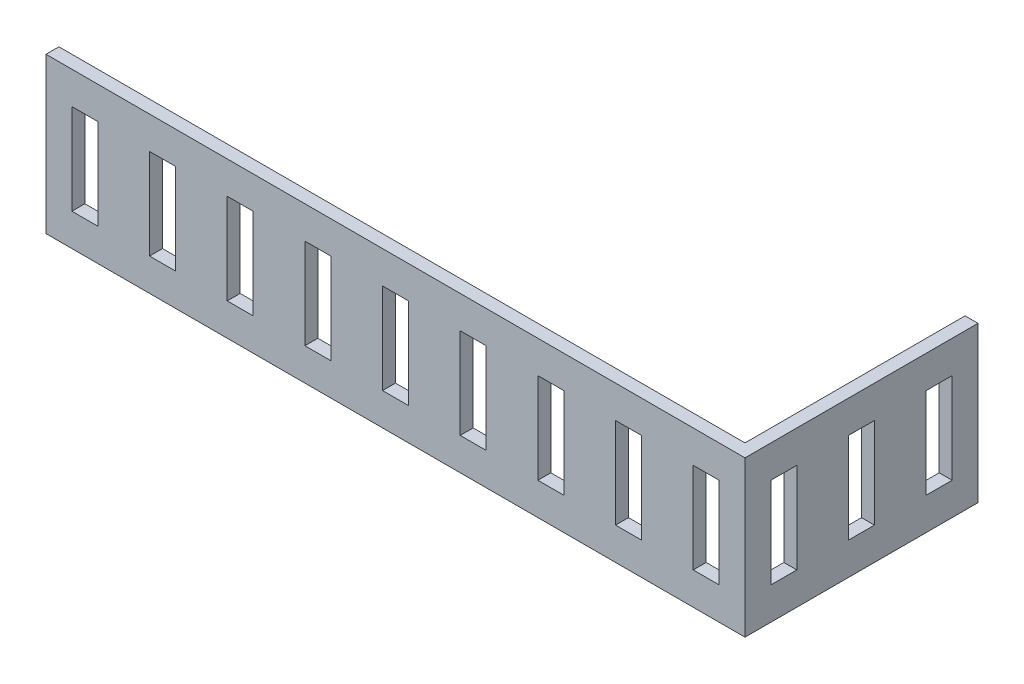
from build123d import *

# Parameters (mm, degrees)
EXTRUDE_1_DEPTH     = 6
SKETCH_2_W          = 1
SKETCH_2_H          = 3.5
CUT_EXTRUDE_1_DEPTH = 30.086079144
SKETCH_3_W          = 1
SKETCH_3_H          = 3.5
CUT_EXTRUDE_2_DEPTH = 6


with BuildPart() as part:
    # 草图1 → 凸台-拉伸1 (new body)
    with BuildSketch(Plane(origin=(0, 0, 0), x_dir=(1, 0, 0), z_dir=(0, 1, 0))):
        Polygon((0, 0), (26.5, 0), (26.5, 8.5), (27, 8.5), (27, -0.5), (0, -0.5), align=None)
    extrude(amount=EXTRUDE_1_DEPTH)

    # 草图2 → 切除-拉伸1 (cut, through all)
    with BuildSketch(Plane.XY.offset(0.5)):
        with Locations((1.5, 3)):
            Rectangle(SKETCH_2_W, SKETCH_2_H)
        with Locations((4.5, 3)):
            Rectangle(SKETCH_2_W, SKETCH_2_H)
        with Locations((7.5, 3)):
            Rectangle(SKETCH_2_W, SKETCH_2_H)
        with Locations((10.5, 3)):
            Rectangle(SKETCH_2_W, SKETCH_2_H)
        with Locations((13.5, 3)):
            Rectangle(SKETCH_2_W, SKETCH_2_H)
        with Locations((16.5, 3)):
            Rectangle(SKETCH_2_W, SKETCH_2_H)
        with Locations((19.5, 3)):
            Rectangle(SKETCH_2_W, SKETCH_2_H)
        with Locations((22.5, 3)):
            Rectangle(SKETCH_2_W, SKETCH_2_H)
        with Locations((25.5, 3)):
            Rectangle(SKETCH_2_W, SKETCH_2_H)
    extrude(amount=-CUT_EXTRUDE_1_DEPTH, mode=Mode.SUBTRACT)

    # 草图3 → 切除-拉伸2 (cut)
    with BuildSketch(Plane(origin=(27, 0, 0), x_dir=(0, 0, -1), z_dir=(1, 0, 0))):
        with Locations((1, 3)):
            Rectangle(SKETCH_3_W, SKETCH_3_H)
        with Locations((4, 3)):
            Rectangle(SKETCH_3_W, SKETCH_3_H)
        with Locations((7, 3)):
            Rectangle(SKETCH_3_W, SKETCH_3_H)
    extrude(amount=-CUT_EXTRUDE_2_DEPTH, mode=Mode.SUBTRACT)


solid = part.part
